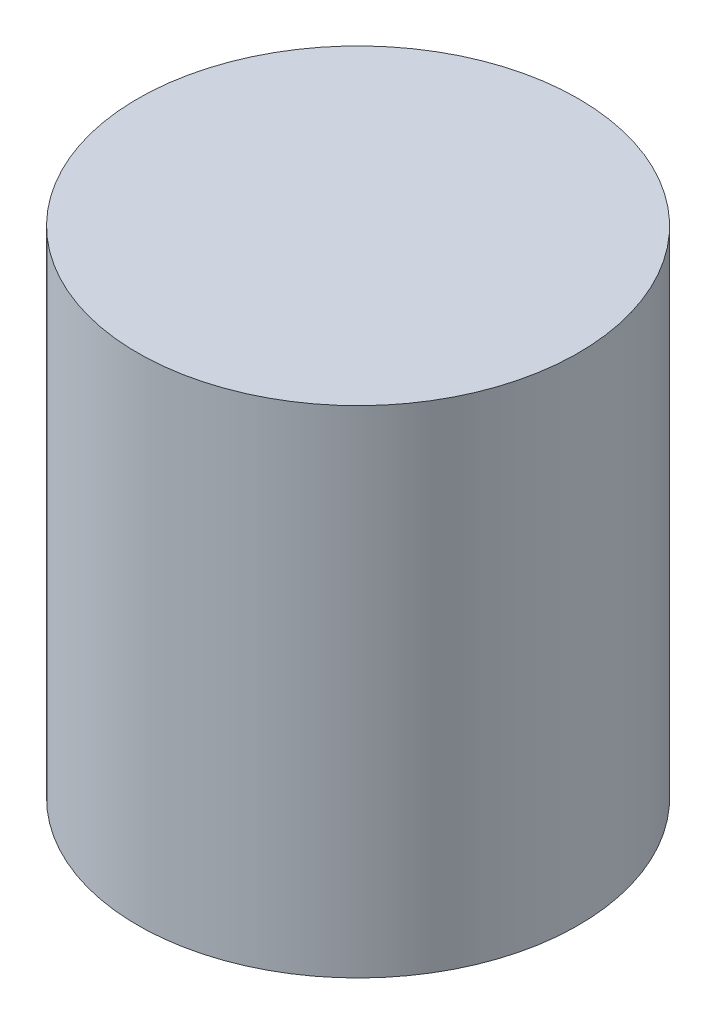
from build123d import *

# Parameters (mm, degrees)
SKETCH1_R           = 20
BOSS_EXTRUDE1_DEPTH = 22.5


with BuildPart() as part:
    # Sketch1 → Boss-Extrude1 (new, symmetric)
    with BuildSketch(Plane(origin=(0, 0, 0), x_dir=(1, 0, 0), z_dir=(0, 1, 0))):
        with Locations(Location((0, 0, 0), (0, 0, 90))):
            Circle(SKETCH1_R)
    extrude(amount=BOSS_EXTRUDE1_DEPTH, both=True)


solid = part.part
